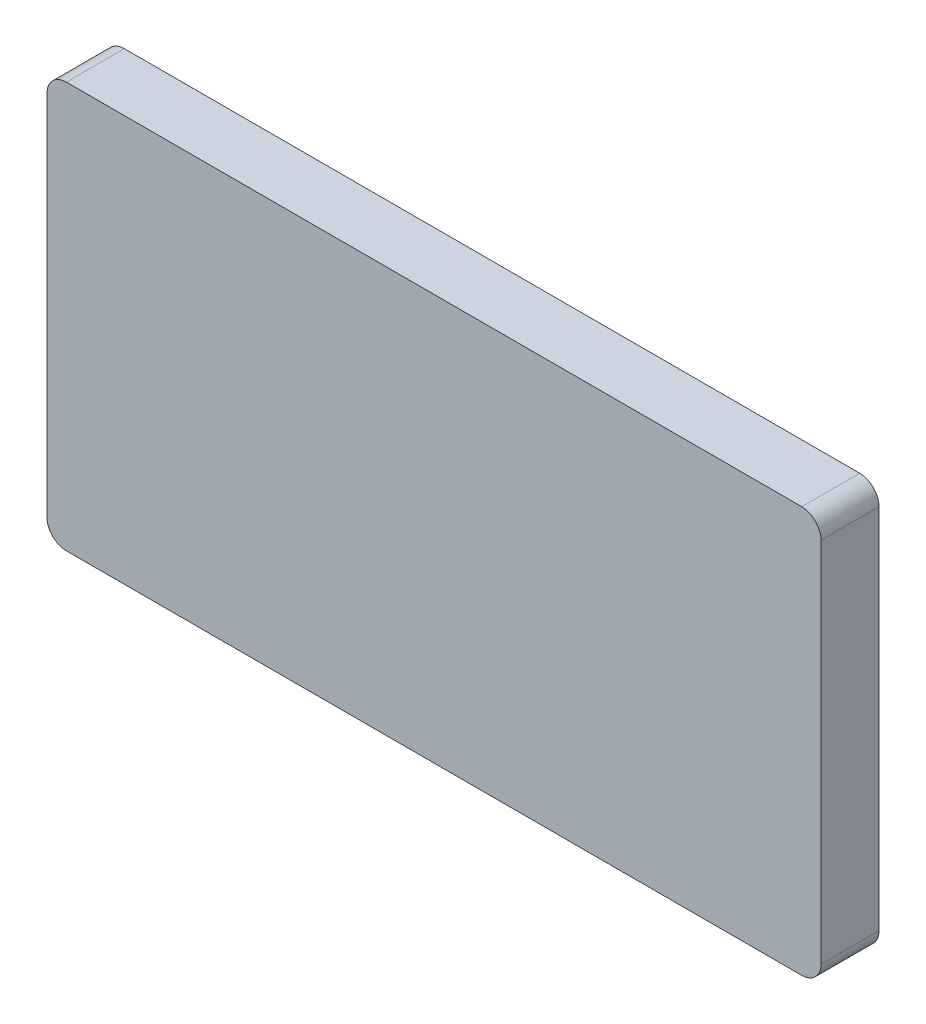
from build123d import *

# Parameters (mm, degrees)
SKETCH1_W           = 80.1
SKETCH1_H           = 42
BOSS_EXTRUDE1_DEPTH = 6
SKETCH2_W           = 76.1
SKETCH2_H           = 38
CUT_EXTRUDE1_DEPTH  = 5.4
FILLET1_R           = 2


with BuildPart() as part:
    # Sketch1 → Boss-Extrude1 (new body)
    with BuildSketch(Plane.XY):
        with Locations((4.05, 0)):
            Rectangle(SKETCH1_W, SKETCH1_H)
    extrude(amount=BOSS_EXTRUDE1_DEPTH)

    # Sketch2 → Cut-Extrude1 (cut)
    with BuildSketch(Plane(origin=(0, 0, 0), x_dir=(-1, 0, 0), z_dir=(0, 0, -1))):
        with Locations((-4.05, 0)):
            Rectangle(SKETCH2_W, SKETCH2_H)
    extrude(amount=-CUT_EXTRUDE1_DEPTH, mode=Mode.SUBTRACT)

    # Fillet1
    fillet1_edges = [part.edges().sort_by_distance(p)[0] for p in [
        (-36, 21, 3),
        (44.1, 21, 3),
        (44.1, -21, 3),
        (-36, -21, 3),
    ]]
    fillet(fillet1_edges, radius=FILLET1_R)


solid = part.part
